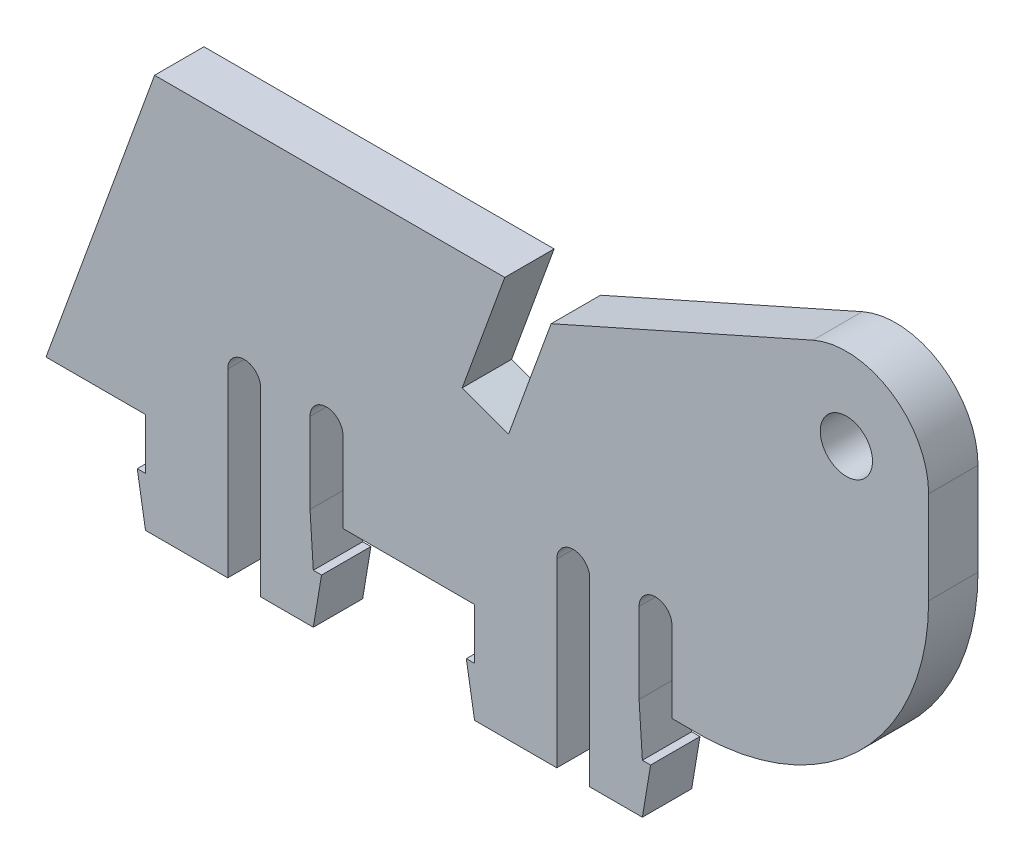
from build123d import *

# Parameters (mm, degrees)
SKETCH1_R           = 1.5875
BOSS_EXTRUDE1_DEPTH = 3
TABS_DEPTH          = 3
TAB_RELIEF_REACH    = 195.217


with BuildPart() as part:
    # Sketch1 → Boss-Extrude1 (new body)
    with BuildSketch(Plane.XY):
        with BuildLine():
            Line((-44.534658728, 169.908603759), (-60.444091073, 162.821196289))
            Line((-60.444091073, 162.821196289), (-63.031525128, 155.712279649))
            Line((-63.031525128, 155.712279649), (-65.85060299, 156.738340079))
            Line((-65.85060299, 156.738340079), (-63.263168935, 163.847256719))
            Line((-63.263168935, 163.847256719), (-84.546724385, 163.847256719))
            Line((-84.546724385, 163.847256719), (-91.147316237, 145.712279649))
            Line((-91.147316237, 145.712279649), (-51.5, 145.712279649))
            ThreePointArc((-51.5, 145.712279649), (-41.600505063, 149.812784712), (-37.5, 159.712279649))
            Line((-37.5, 159.712279649), (-37.5, 165.341310922))
            ThreePointArc((-37.5, 165.341310922), (-39.777252641, 169.534954543), (-44.534658728, 169.908603759))
        make_face()
        with Locations((-42.5, 165.341310922)):
            Circle(SKETCH1_R, mode=Mode.SUBTRACT)
    extrude(amount=BOSS_EXTRUDE1_DEPTH)

    # Sketch3 → tabs (add)
    with BuildSketch(Plane(origin=(0, 0, 0), x_dir=(-1, 0, 0), z_dir=(0, 0, -1))):
        with BuildLine():
            Line((54.9, 142.612279649), (55.1, 145.712279649))
            Line((55.1, 145.712279649), (55.1, 150.612279649))
            ThreePointArc((55.1, 150.612279649), (54.1, 151.612279649), (53.1, 150.612279649))
            Line((53.1, 150.612279649), (53.1, 145.712279649))
            Line((53.1, 145.712279649), (51.1, 145.712279649))
            Line((51.1, 145.712279649), (51.1, 152.712279649))
            Line((51.1, 152.712279649), (67.1, 152.712279649))
            Line((67.1, 152.712279649), (67.1, 145.712279649))
            Line((67.1, 145.712279649), (65.1, 145.712279649))
            Line((65.1, 145.712279649), (65.1, 142.612279649))
            Line((65.1, 142.612279649), (65.6, 142.612279649))
            Line((65.6, 142.612279649), (65.1, 139.612279649))
            Line((65.1, 139.612279649), (60.1, 139.612279649))
            Line((60.1, 139.612279649), (60.1, 150.612279649))
            ThreePointArc((60.1, 150.612279649), (59.1, 151.612279649), (58.1, 150.612279649))
            Line((58.1, 150.612279649), (58.1, 139.612279649))
            Line((58.1, 139.612279649), (54.9, 139.612279649))
            Line((54.9, 139.612279649), (54.4, 142.612279649))
            Line((54.4, 142.612279649), (54.9, 142.612279649))
        make_face()
        with BuildLine():
            Line((74.9, 142.612279649), (75.1, 145.712279649))
            Line((75.1, 145.712279649), (75.1, 150.612279649))
            ThreePointArc((75.1, 150.612279649), (74.1, 151.612279649), (73.1, 150.612279649))
            Line((73.1, 150.612279649), (73.1, 145.712279649))
            Line((73.1, 145.712279649), (71.1, 145.712279649))
            Line((71.1, 145.712279649), (71.1, 152.712279649))
            Line((71.1, 152.712279649), (87.1, 152.712279649))
            Line((87.1, 152.712279649), (87.1, 145.712279649))
            Line((87.1, 145.712279649), (85.1, 145.712279649))
            Line((85.1, 145.712279649), (85.1, 142.612279649))
            Line((85.1, 142.612279649), (85.6, 142.612279649))
            Line((85.6, 142.612279649), (85.1, 139.612279649))
            Line((85.1, 139.612279649), (80.1, 139.612279649))
            Line((80.1, 139.612279649), (80.1, 150.612279649))
            ThreePointArc((80.1, 150.612279649), (79.1, 151.612279649), (78.1, 150.612279649))
            Line((78.1, 150.612279649), (78.1, 139.612279649))
            Line((78.1, 139.612279649), (74.9, 139.612279649))
            Line((74.9, 139.612279649), (74.4, 142.612279649))
            Line((74.4, 142.612279649), (74.9, 142.612279649))
        make_face()
    extrude(amount=-TABS_DEPTH)

    # Sketch4 → tab relief (cut, up to next)
    with BuildSketch(Plane(origin=(0, 0, 0), x_dir=(-1, 0, 0), z_dir=(0, 0, -1)), mode=Mode.PRIVATE) as tab_relief_sk1:
        with BuildLine():
            Line((55.1, 145.712279649), (55.1, 150.612279649))
            ThreePointArc((55.1, 150.612279649), (54.1, 151.612279649), (53.1, 150.612279649))
            Line((53.1, 150.612279649), (53.1, 145.712279649))
            Line((53.1, 145.712279649), (55.1, 145.712279649))
        make_face()
    tab_relief_tool1 = extrude(tab_relief_sk1.sketch, amount=-TAB_RELIEF_REACH, mode=Mode.PRIVATE) & part.part
    # Sketch4 → tab relief (cut, up to next)
    with BuildSketch(Plane(origin=(0, 0, 0), x_dir=(-1, 0, 0), z_dir=(0, 0, -1)), mode=Mode.PRIVATE) as tab_relief_sk2:
        with BuildLine():
            Line((75.1, 145.712279649), (75.1, 150.612279649))
            ThreePointArc((75.1, 150.612279649), (74.1, 151.612279649), (73.1, 150.612279649))
            Line((73.1, 150.612279649), (73.1, 145.712279649))
            Line((73.1, 145.712279649), (75.1, 145.712279649))
        make_face()
    tab_relief_tool2 = extrude(tab_relief_sk2.sketch, amount=-TAB_RELIEF_REACH, mode=Mode.PRIVATE) & part.part
    # Sketch4 → tab relief (cut, up to next)
    with BuildSketch(Plane(origin=(0, 0, 0), x_dir=(-1, 0, 0), z_dir=(0, 0, -1)), mode=Mode.PRIVATE) as tab_relief_sk3:
        with BuildLine():
            Line((58.1, 150.612279649), (58.1, 145.712279649))
            Line((58.1, 145.712279649), (60.1, 145.712279649))
            Line((60.1, 145.712279649), (60.1, 150.612279649))
            ThreePointArc((60.1, 150.612279649), (59.1, 151.612279649), (58.1, 150.612279649))
        make_face()
    tab_relief_tool3 = extrude(tab_relief_sk3.sketch, amount=-TAB_RELIEF_REACH, mode=Mode.PRIVATE) & part.part
    # Sketch4 → tab relief (cut, up to next)
    with BuildSketch(Plane(origin=(0, 0, 0), x_dir=(-1, 0, 0), z_dir=(0, 0, -1)), mode=Mode.PRIVATE) as tab_relief_sk4:
        with BuildLine():
            Line((78.1, 150.612279649), (78.1, 145.712279649))
            Line((78.1, 145.712279649), (80.1, 145.712279649))
            Line((80.1, 145.712279649), (80.1, 150.612279649))
            ThreePointArc((80.1, 150.612279649), (79.1, 151.612279649), (78.1, 150.612279649))
        make_face()
    tab_relief_tool4 = extrude(tab_relief_sk4.sketch, amount=-TAB_RELIEF_REACH, mode=Mode.PRIVATE) & part.part
    add(tab_relief_tool1.solids().sort_by_distance((-54.1, 148.55936, 0))[0], mode=Mode.SUBTRACT)
    add(tab_relief_tool2.solids().sort_by_distance((-74.1, 148.55936, 0))[0], mode=Mode.SUBTRACT)
    add(tab_relief_tool3.solids().sort_by_distance((-59.1, 148.55936, 0))[0], mode=Mode.SUBTRACT)
    add(tab_relief_tool4.solids().sort_by_distance((-79.1, 148.55936, 0))[0], mode=Mode.SUBTRACT)


solid = part.part
